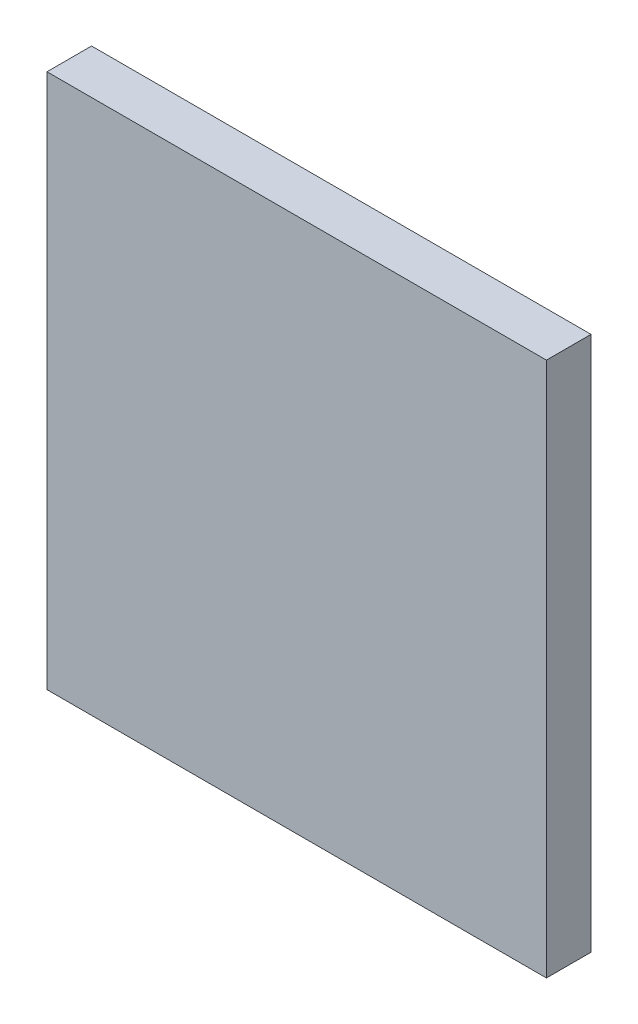
from build123d import *

# Parameters (mm, degrees)
SKETCH_1_W       = 56
SKETCH_1_H       = 60
FIXED_BASE_DEPTH = 5


with BuildPart() as part:
    # 草图1 → Fixed_Base (new body)
    with BuildSketch(Plane.XY):
        with Locations((28, 30)):
            Rectangle(SKETCH_1_W, SKETCH_1_H)
    extrude(amount=FIXED_BASE_DEPTH)


solid = part.part
